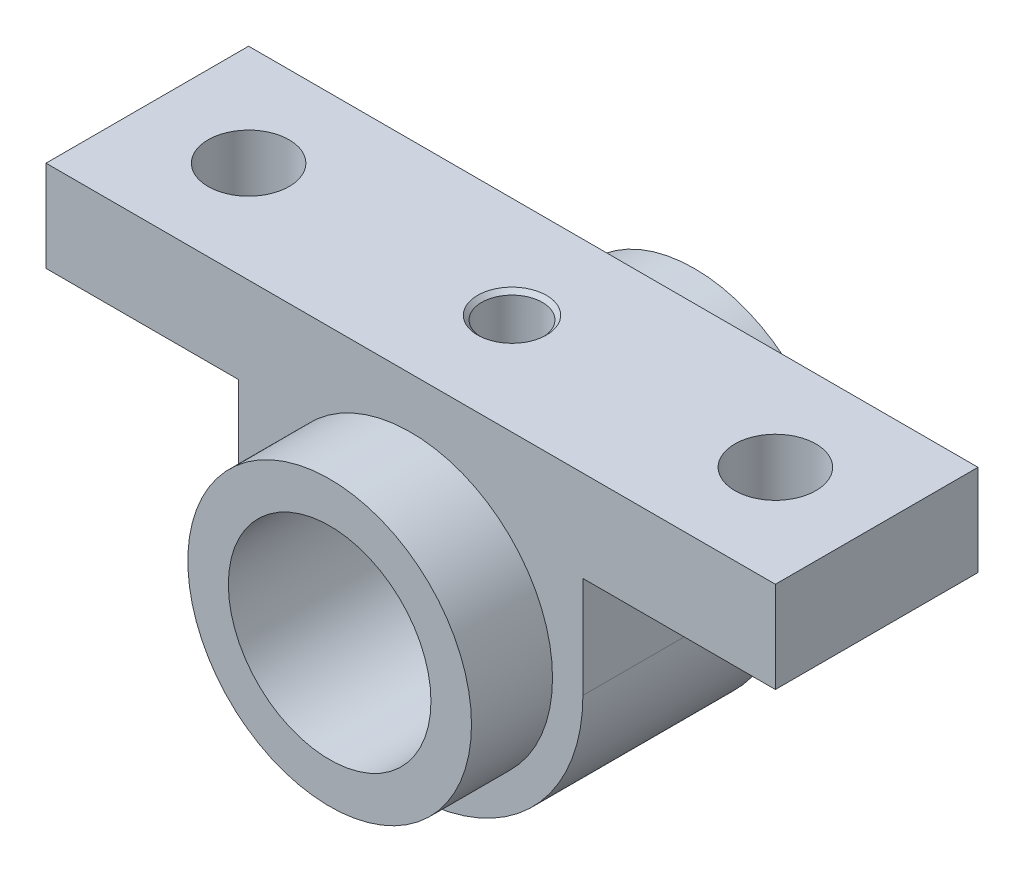
from build123d import *

# Parameters (mm, degrees)
SKETCH1_R           = 5
BOSS_EXTRUDE1_DEPTH = 10
SKETCH2_R           = 7
SKETCH2_R_2         = 5
BOSS_EXTRUDE2_DEPTH = 4
BOSS_EXTRUDE3_START = 4
SKETCH3_R           = 7
SKETCH3_R_2         = 5
BOSS_EXTRUDE3_DEPTH = 4
SKETCH4_R           = 1.5
SKETCH4_R_2         = 2
CUT_EXTRUDE1_DEPTH  = 7
CHAMFER1_SIZE       = 0.2


with BuildPart() as part:
    # Sketch1 → Boss-Extrude1 (new body)
    with BuildSketch(Plane.XY):
        with BuildLine():
            Line((0, -4.5), (9.5, -4.5))
            Line((9.5, -4.5), (9.5, -9.5))
            ThreePointArc((9.5, -9.5), (18, -18), (26.5, -9.5))
            Line((26.5, -9.5), (26.5, -4.5))
            Line((26.5, -4.5), (36, -4.5))
            Line((36, -4.5), (36, 0))
            Line((36, 0), (0, 0))
            Line((0, 0), (0, -4.5))
        make_face()
        with Locations((18, -9.5)):
            Circle(SKETCH1_R, mode=Mode.SUBTRACT)
    extrude(amount=BOSS_EXTRUDE1_DEPTH)

    # Sketch2 → Boss-Extrude2 (add)
    with BuildSketch(Plane.XY.offset(10)):
        with Locations((18, -9.5)):
            Circle(SKETCH2_R)
        with Locations((18, -9.5)):
            Circle(SKETCH2_R_2, mode=Mode.SUBTRACT)
    extrude(amount=BOSS_EXTRUDE2_DEPTH)

    # Sketch3 → Boss-Extrude3 (add)
    with BuildSketch(Plane(origin=(0, 0, 0), x_dir=(-1, 0, 0), z_dir=(0, 0, -1)).offset(BOSS_EXTRUDE3_START)):
        with Locations(Location((-18, -9.5, 0), (0, 0, 180))):
            Circle(SKETCH3_R)
        with Locations((-18, -9.5)):
            Circle(SKETCH3_R_2, mode=Mode.SUBTRACT)
    extrude(amount=-BOSS_EXTRUDE3_DEPTH)

    # Sketch4 → Cut-Extrude1 (cut)
    with BuildSketch(Plane(origin=(0, 0, 0), x_dir=(1, 0, 0), z_dir=(0, 1, 0))):
        with Locations(Location((18, -5, 0), (0, 0, 270))):
            Circle(SKETCH4_R)
        with Locations(Location((5, -5, 0), (0, 0, 270))):
            Circle(SKETCH4_R_2)
        with Locations(Location((31, -5, 0), (0, 0, 270))):
            Circle(SKETCH4_R_2)
    extrude(amount=-CUT_EXTRUDE1_DEPTH, mode=Mode.SUBTRACT)

    # Chamfer1
    chamfer1_edges = [part.edges().sort_by_distance(p)[0] for p in [
        (18, 0, 3.5),
    ]]
    chamfer(chamfer1_edges, length=CHAMFER1_SIZE)


solid = part.part
